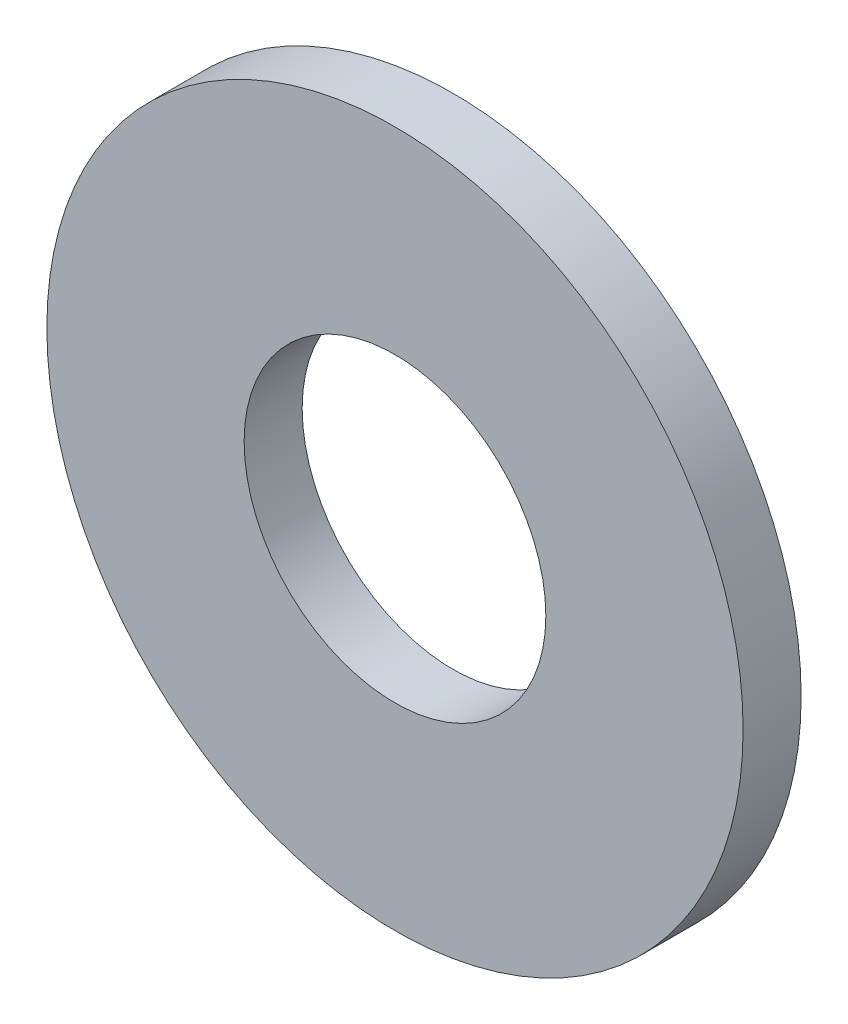
from build123d import *

# Parameters (mm, degrees)
SKETCH1_R           = 6
SKETCH1_R_2         = 2.6
BOSS_EXTRUDE1_DEPTH = 1


with BuildPart() as part:
    # Sketch1 → Boss-Extrude1 (new body)
    with BuildSketch(Plane.XY):
        Circle(SKETCH1_R)
        Circle(SKETCH1_R_2, mode=Mode.SUBTRACT)
    extrude(amount=BOSS_EXTRUDE1_DEPTH)


solid = part.part
